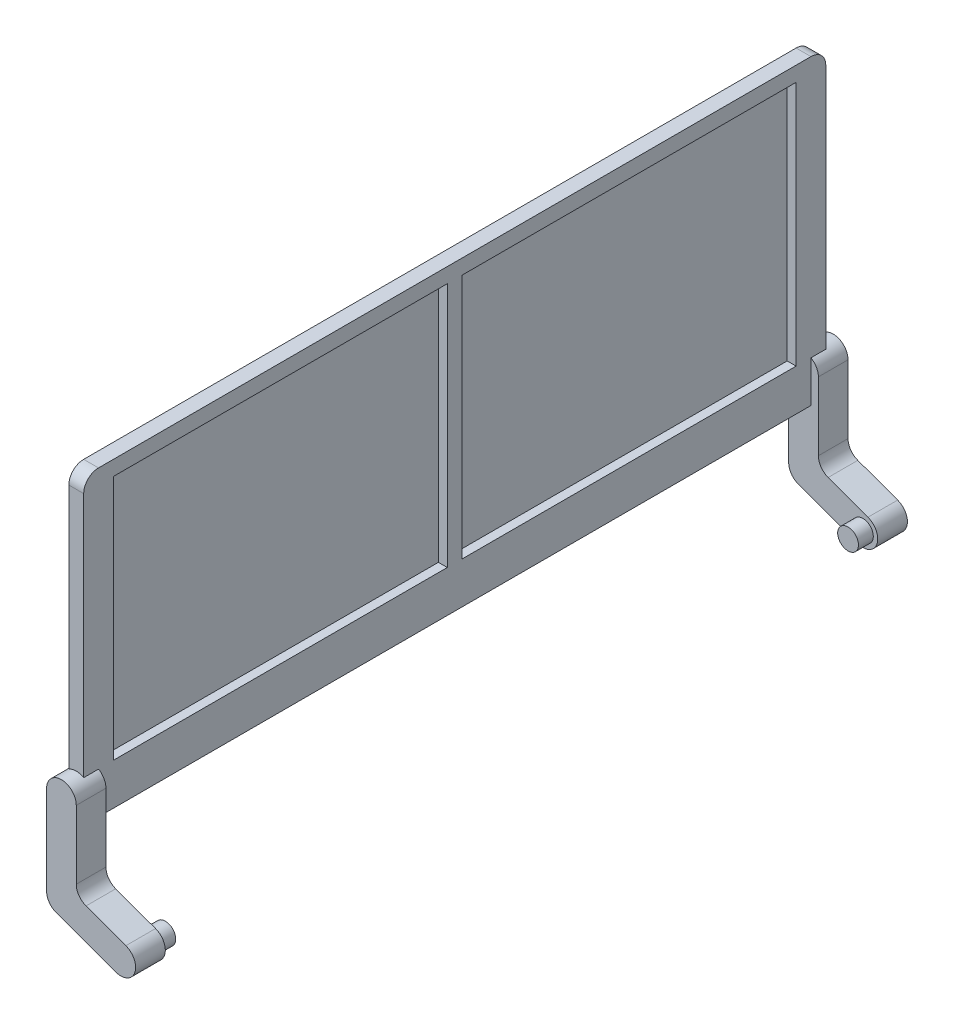
from build123d import *

# Parameters (mm, degrees)
SKETCH1_W             = 112.5
SKETCH1_H             = 82.8
BOSS_EXTRUDE1_DEPTH   = 5
CUT_EXTRUDE1_DEPTH    = 270.978221344
BOSS_EXTRUDE2_DEPTH   = 5
SKETCH4_R             = 3.5
BOSS_EXTRUDE3_DEPTH   = 5
CHAMFER3_SIZE         = 2
SKETCH6_W             = 116.5
SKETCH6_H             = 86.8
BOSS_EXTRUDE4_DEPTH   = 1
BOSS_EXTRUDE4_2_DEPTH = 1


with BuildPart() as part:
    # Sketch1 → Boss-Extrude1 (new body)
    with BuildSketch(Plane(origin=(0, 0, 0), x_dir=(0, 0, -1), z_dir=(1, 0, 0))):
        with BuildLine():
            Line((-120, 101.8), (120, 101.8))
            ThreePointArc((120, 101.8), (123.535533906, 100.335533906), (125, 96.8))
            Line((125, 96.8), (125, 0))
            Line((125, 0), (-125, 0))
            Line((-125, 0), (-125, 96.8))
            ThreePointArc((-125, 96.8), (-123.535533906, 100.335533906), (-120, 101.8))
        make_face()
        with Locations((58.75, 55.4)):
            Rectangle(SKETCH1_W, SKETCH1_H, mode=Mode.SUBTRACT)
        with Locations((-58.75, 55.4)):
            Rectangle(SKETCH1_W, SKETCH1_H, mode=Mode.SUBTRACT)
    extrude(amount=-BOSS_EXTRUDE1_DEPTH)

    # Sketch2 → Cut-Extrude1 (cut, through all)
    with BuildSketch(Plane.XY.offset(125)):
        Polygon((-5, 0), (0, 0), (-5, 1.819851171), align=None)
    extrude(amount=-CUT_EXTRUDE1_DEPTH, mode=Mode.SUBTRACT)

    # Chamfer3
    chamfer3_edges = [part.edges().sort_by_distance(p)[0] for p in [
        (-5, 55.4, 115),
        (-5, 96.8, 58.75),
        (-5, 55.4, 2.5),
        (-5, 14, 58.75),
        (-5, 55.4, -115),
        (-5, 14, -58.75),
        (-5, 55.4, -2.5),
        (-5, 96.8, -58.75),
    ]]
    chamfer(chamfer3_edges, length=CHAMFER3_SIZE)


with BuildPart() as body_2:
    # Sketch3 → Boss-Extrude2 (new, symmetric)
    with BuildSketch(Plane.XY.offset(125)):
        with BuildLine():
            Line((-7.5, 9.6), (-7.5, -20.4))
            ThreePointArc((-7.5, -20.4), (-6.595760221, -23.267882182), (-4.210100717, -25.098463104))
            Line((-4.210100717, -25.098463104), (15.789899283, -32.377867789))
            ThreePointArc((15.789899283, -32.377867789), (22.198463104, -29.389505402), (19.210100717, -22.980941581))
            Line((19.210100717, -22.980941581), (5.789899283, -18.096387722))
            ThreePointArc((5.789899283, -18.096387722), (3.404239779, -16.2658068), (2.5, -13.397924618))
            Line((2.5, -13.397924618), (2.5, 9.6))
            ThreePointArc((2.5, 9.6), (-2.5, 14.6), (-7.5, 9.6))
        make_face()
    extrude(amount=BOSS_EXTRUDE2_DEPTH, both=True)

    # Sketch4 → Boss-Extrude3 (add)
    with BuildSketch(Plane(origin=(0, 0, 120), x_dir=(-1, 0, 0), z_dir=(0, 0, -1))):
        with Locations((-17.5, -27.679404685)):
            Circle(SKETCH4_R)
    extrude(amount=BOSS_EXTRUDE3_DEPTH)


with BuildPart() as body_3:
    # Mirror1: mirrored copy
    add(body_2.part.mirror(Plane.XY))


with BuildPart() as body_4:
    # Sketch6 → Boss-Extrude4 (new body)
    with BuildSketch(Plane.ZY.offset(5)):
        with Locations((58.75, 55.4)):
            Rectangle(SKETCH6_W, SKETCH6_H)
    extrude(amount=-BOSS_EXTRUDE4_DEPTH)


with BuildPart() as body_5:
    # Sketch6 → Boss-Extrude4 2 (new body)
    with BuildSketch(Plane.ZY.offset(5)):
        with Locations((-58.75, 55.4)):
            Rectangle(SKETCH6_W, SKETCH6_H)
    extrude(amount=-BOSS_EXTRUDE4_2_DEPTH)


solid = Compound([part.part, body_2.part, body_3.part, body_4.part, body_5.part])
